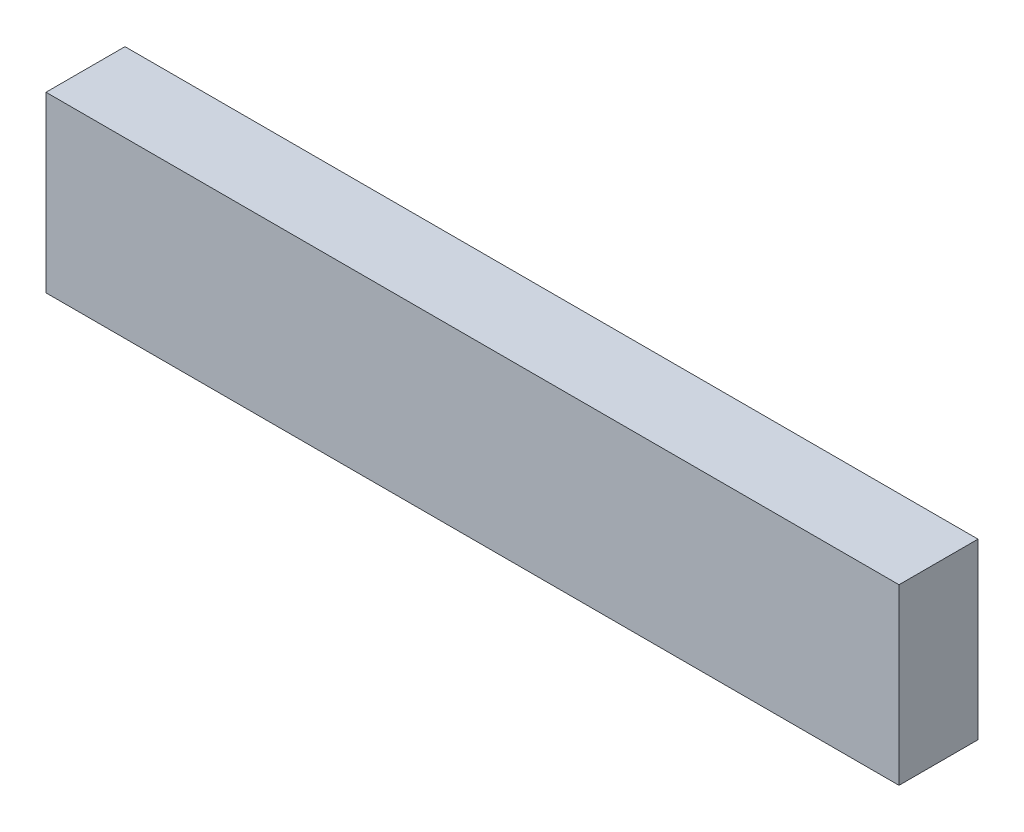
from build123d import *

# Parameters (mm, degrees)
SKETCH_1_W      = 270
SKETCH_1_H      = 55
EXTRUDE_1_DEPTH = 25


with BuildPart() as part:
    # 草图1 → 凸台-拉伸1 (new body)
    with BuildSketch(Plane.XY):
        with Locations((82.308209184, -1.527805236)):
            Rectangle(SKETCH_1_W, SKETCH_1_H)
    extrude(amount=EXTRUDE_1_DEPTH)


solid = part.part
